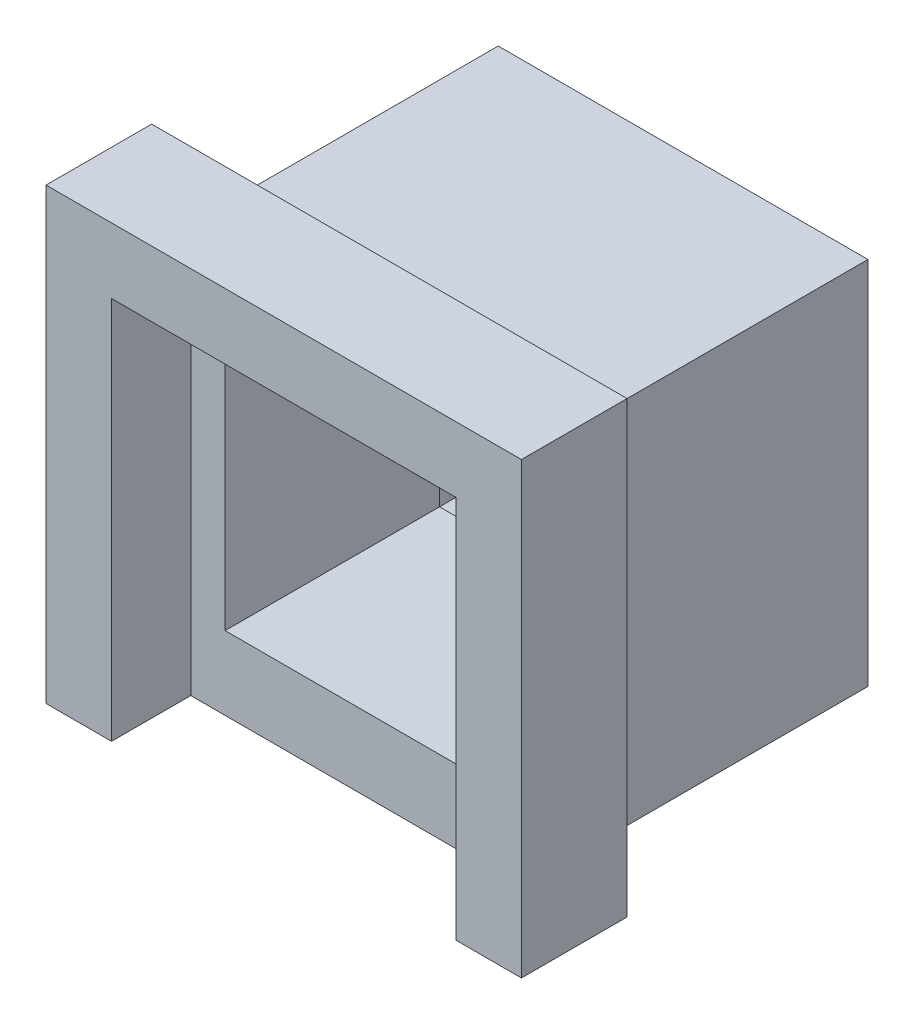
from build123d import *

# Parameters (mm, degrees)
SKETCH2_W           = 3.5
SKETCH2_H           = 3.5
SKETCH2_W_2         = 2.61
SKETCH2_H_2         = 2.61
BOSS_EXTRUDE1_DEPTH = 3.78
SKETCH3_W           = 3.1
SKETCH3_H           = 3.1
SKETCH3_W_2         = 2.61
SKETCH3_H_2         = 2.61
CUT_EXTRUDE1_DEPTH  = 1
SKETCH4_W           = 4.5
SKETCH4_H           = 4.25
SKETCH4_W_2         = 3.5
SKETCH4_H_2         = 3.5
BOSS_EXTRUDE2_DEPTH = 1
SKETCH5_W           = 3.26
SKETCH5_H           = 6.003564401
CUT_EXTRUDE2_DEPTH  = 0.75


with BuildPart() as part:
    # Sketch2 → Boss-Extrude1 (new body)
    with BuildSketch(Plane.XY):
        Rectangle(SKETCH2_W, SKETCH2_H)
        Rectangle(SKETCH2_W_2, SKETCH2_H_2, mode=Mode.SUBTRACT)
    extrude(amount=BOSS_EXTRUDE1_DEPTH)

    # Sketch3 → Cut-Extrude1 (cut)
    with BuildSketch(Plane.XY):
        Rectangle(SKETCH3_W, SKETCH3_H)
        Rectangle(SKETCH3_W_2, SKETCH3_H_2, mode=Mode.SUBTRACT)
    extrude(amount=CUT_EXTRUDE1_DEPTH, mode=Mode.SUBTRACT)

    # Sketch4 → Boss-Extrude2 (add)
    with BuildSketch(Plane.XY.offset(3.78)):
        with Locations((0, 0.125)):
            Rectangle(SKETCH4_W, SKETCH4_H)
        Rectangle(SKETCH4_W_2, SKETCH4_H_2, mode=Mode.SUBTRACT)
    extrude(amount=-BOSS_EXTRUDE2_DEPTH)

    # Sketch5 → Cut-Extrude2 (cut)
    with BuildSketch(Plane.XY.offset(3.78)):
        with Locations((0, -1.371782201)):
            Rectangle(SKETCH5_W, SKETCH5_H)
    extrude(amount=-CUT_EXTRUDE2_DEPTH, mode=Mode.SUBTRACT)


solid = part.part
